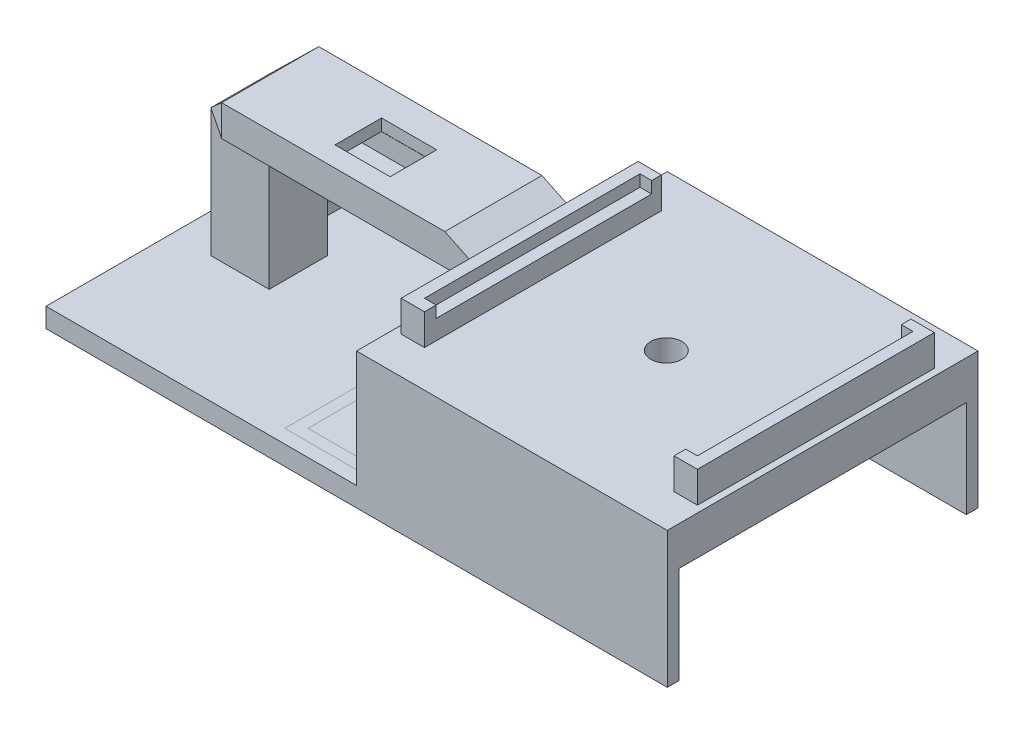
from build123d import *

# Parameters (mm, degrees)
ESQUISSE1_W                  = 150
ESQUISSE1_H                  = 80
BOSS_EXTRU_1_DEPTH           = 5
ESQUISSE2_W                  = 80
ESQUISSE2_H                  = 80
BOSS_EXTRU_2_DEPTH           = 30
ESQUISSE3_W                  = 75
ESQUISSE3_H                  = 80
ENL_V_MAT_EXTRU_1_DEPTH      = 25
ESQUISSE6_R                  = 4
ENL_V_MAT_EXTRU_2_DEPTH      = 40
ESQUISSE7_W                  = 6
ESQUISSE7_H                  = 61
BOSS_EXTRU_3_DEPTH           = 8
ESQUISSE9_W                  = 3
ESQUISSE9_H                  = 50
BOSS_EXTRU_4_DEPTH           = 0.0001
ESQUISSE10_W                 = 3
ESQUISSE10_H                 = 55.5
ENL_V_MAT_EXTRU_3_DEPTH      = 3
ESQUISSE11_W                 = 3
ESQUISSE11_H                 = 55.5
ENL_V_MAT_EXTRU_4_DEPTH      = 3
ESQUISSE12_W                 = 15
ESQUISSE12_H                 = 15
BOSS_EXTRU_5_DEPTH           = 40
BOSS_EXTRU_6_DEPTH           = 1
BOSS_EXTRU_6_DEPTH_BACK      = 7
ESQUISSE13_W                 = 44
ESQUISSE13_H                 = 25
BOSS_EXTRU_7_DEPTH           = 1
BOSS_EXTRU_7_DEPTH_BACK      = 7
ESQUISSE16_W                 = 23
ESQUISSE16_H                 = 12
ENL_V_MAT_EXTRU_5_DEPTH      = 5
ESQUISSE18_W                 = 14.2
ESQUISSE18_H                 = 12
ENL_V_MAT_EXTRU_7_DEPTH      = 5
ESQUISSE19_W                 = 25
ESQUISSE19_H                 = 8
BOSS_EXTRU_8_DEPTH           = 20
ENL_V_MAT_EXTRU_8_DEPTH      = 103.197148685
ESQUISSE21_W                 = 1.984335448
ESQUISSE21_H                 = 3
BOSS_EXTRU_9_DEPTH           = 25
ESQUISSE22_W                 = 3
ESQUISSE22_H                 = 25
BOSS_EXTRU_10_DEPTH          = 75
ESQUISSE23_W                 = 80
ESQUISSE23_H                 = 5
BOSS_EXTRU_11_DEPTH          = 9.96
ESQUISSE24_W                 = 11.416766346
ESQUISSE24_H                 = 16.447883718
BOSS_EXTRU_12_DEPTH          = 3
ENL_V_MAT_EXTRU_9_DEPTH      = 108.658959683
ENL_V_MAT_EXTRU_9_DEPTH_BACK = 108.658959683


with BuildPart() as part:
    # Esquisse1 → Boss.-Extru.1 (new body)
    with BuildSketch(Plane(origin=(0, 0, 0), x_dir=(1, 0, 0), z_dir=(0, 1, 0))):
        Rectangle(ESQUISSE1_W, ESQUISSE1_H)
    extrude(amount=BOSS_EXTRU_1_DEPTH)

    # Esquisse2 → Boss.-Extru.2 (add)
    with BuildSketch(Plane(origin=(0, 5, 0), x_dir=(1, 0, 0), z_dir=(0, 1, 0))):
        with Locations((35, 0)):
            Rectangle(ESQUISSE2_W, ESQUISSE2_H)
    extrude(amount=BOSS_EXTRU_2_DEPTH)

    # Esquisse3 → Enlèv. mat.-Extru.1 (cut)
    with BuildSketch(Plane.XZ):
        with Locations((37.5, 0)):
            Rectangle(ESQUISSE3_W, ESQUISSE3_H)
    extrude(amount=-ENL_V_MAT_EXTRU_1_DEPTH, mode=Mode.SUBTRACT)

    # Esquisse6 → Enlèv. mat.-Extru.2 (cut)
    with BuildSketch(Plane(origin=(0, 35, 0), x_dir=(1, 0, 0), z_dir=(0, 1, 0))):
        with Locations(Location((34.753416048, 0, 0), (0, 0, 270))):
            Circle(ESQUISSE6_R)
    extrude(amount=-ENL_V_MAT_EXTRU_2_DEPTH, mode=Mode.SUBTRACT)

    # Esquisse7 → Boss.-Extru.3 (add)
    with BuildSketch(Plane(origin=(0, 35, 0), x_dir=(1, 0, 0), z_dir=(0, 1, 0))):
        with Locations((-0.015664552, 0)):
            Rectangle(ESQUISSE7_W, ESQUISSE7_H)
        with Locations((70.25575127, 0)):
            Rectangle(ESQUISSE7_W, ESQUISSE7_H)
    extrude(amount=BOSS_EXTRU_3_DEPTH)

    # Esquisse9 → Boss.-Extru.4 (add)
    with BuildSketch(Plane(origin=(0, 5, 0), x_dir=(1, 0, 0), z_dir=(0, 1, 0))):
        Polygon((-27, -36.47894853), (-5, -36.47894853), (-5, -33.47894853), (-24, -33.47894853), (-27, -33.47894853), align=None)
        with Locations((-25.5, -8.47894853)):
            Rectangle(ESQUISSE9_W, ESQUISSE9_H)
    extrude(amount=BOSS_EXTRU_4_DEPTH)

    # Esquisse10 → Enlèv. mat.-Extru.3 (cut)
    with BuildSketch(Plane(origin=(0, 43, 0), x_dir=(1, 0, 0), z_dir=(0, 1, 0))):
        with Locations((1.484335448, 0.25)):
            Rectangle(ESQUISSE10_W, ESQUISSE10_H)
    extrude(amount=-ENL_V_MAT_EXTRU_3_DEPTH, mode=Mode.SUBTRACT)

    # Esquisse11 → Enlèv. mat.-Extru.4 (cut)
    with BuildSketch(Plane(origin=(0, 43, 0), x_dir=(1, 0, 0), z_dir=(0, 1, 0))):
        with Locations((68.75575127, 0.25)):
            Rectangle(ESQUISSE11_W, ESQUISSE11_H)
    extrude(amount=-ENL_V_MAT_EXTRU_4_DEPTH, mode=Mode.SUBTRACT)

    # Esquisse12 → Boss.-Extru.5 (add)
    with BuildSketch(Plane(origin=(0, 5, 0), x_dir=(1, 0, 0), z_dir=(0, 1, 0))):
        with Locations((-67.5, 0)):
            Rectangle(ESQUISSE12_W, ESQUISSE12_H)
    extrude(amount=BOSS_EXTRU_5_DEPTH)

    # Esquisse13 → Boss.-Extru.6 (add, two sides: drawn at the far end of the back side and taken through both)
    with BuildSketch(Plane(origin=(0, 45, 0), x_dir=(1, 0, 0), z_dir=(0, 1, 0)).offset(-BOSS_EXTRU_6_DEPTH_BACK)):
        with Locations((-44.729487472, -0.507142805)):
            Rectangle(ESQUISSE13_W, ESQUISSE13_H)
    extrude(amount=BOSS_EXTRU_6_DEPTH + BOSS_EXTRU_6_DEPTH_BACK)

    # Esquisse14 → Boss.-Extru.7 (add, two sides: drawn at the far end of the back side and taken through both)
    with BuildSketch(Plane(origin=(0, 45, 0), x_dir=(1, 0, 0), z_dir=(0, 1, 0)).offset(-BOSS_EXTRU_7_DEPTH_BACK)):
        Polygon((-66.729487472, -13.007142805), (-75, -7.5), (-75, 7.5), (-66.729487472, 11.992857195), align=None)
    extrude(amount=BOSS_EXTRU_7_DEPTH + BOSS_EXTRU_7_DEPTH_BACK)

    # Esquisse16 → Enlèv. mat.-Extru.5 (cut)
    with BuildSketch(Plane.XZ.offset(-38)):
        with Locations((-40, 1.869279691)):
            Rectangle(ESQUISSE16_W, ESQUISSE16_H)
    extrude(amount=-ENL_V_MAT_EXTRU_5_DEPTH, mode=Mode.SUBTRACT)

    # Esquisse18 → Enlèv. mat.-Extru.7 (cut)
    with BuildSketch(Plane.XZ.offset(-43)):
        with Locations((-35.637534585, 1.827095349)):
            Rectangle(ESQUISSE18_W, ESQUISSE18_H)
    extrude(amount=-ENL_V_MAT_EXTRU_7_DEPTH, mode=Mode.SUBTRACT)

    # Esquisse19 → Boss.-Extru.8 (add)
    with BuildSketch(Plane(origin=(-22.729487472, 0, 0), x_dir=(0, 0, -1), z_dir=(1, 0, 0))):
        with Locations((-0.507142805, 42)):
            Rectangle(ESQUISSE19_W, ESQUISSE19_H)
    extrude(amount=BOSS_EXTRU_8_DEPTH)

    # Esquisse20 → Enlèv. mat.-Extru.8 (cut, through all)
    with BuildSketch(Plane(origin=(0, 0, -11.992857195), x_dir=(-1, 0, 0), z_dir=(0, 0, -1))):
        Polygon((3.015664552, 43), (9.263117513, 46), (2.729487472, 46), (2.729487472, 43), align=None)
    extrude(amount=-ENL_V_MAT_EXTRU_8_DEPTH, mode=Mode.SUBTRACT)

    # Esquisse21 → Boss.-Extru.9 (add)
    with BuildSketch(Plane(origin=(0, 0, -11.992857195), x_dir=(-1, 0, 0), z_dir=(0, 0, -1))):
        with Locations((4.007832276, 36.5)):
            Rectangle(ESQUISSE21_W, ESQUISSE21_H)
    extrude(amount=-BOSS_EXTRU_9_DEPTH)

    # Esquisse22 → Boss.-Extru.10 (add)
    with BuildSketch(Plane(origin=(0, 0, 0), x_dir=(0, 0, -1), z_dir=(1, 0, 0))):
        with Locations((-38.5, 12.5)):
            Rectangle(ESQUISSE22_W, ESQUISSE22_H)
    boss_extru_10 = extrude(amount=BOSS_EXTRU_10_DEPTH)

    # Symétrie1: Boss.-Extru.10 across plane
    add(boss_extru_10.mirror(Plane.XY))

    # Esquisse23 → Boss.-Extru.11 (add)
    with BuildSketch(Plane.ZY.offset(75)):
        with Locations((0, 2.5)):
            Rectangle(ESQUISSE23_W, ESQUISSE23_H)
    extrude(amount=BOSS_EXTRU_11_DEPTH)

    # Esquisse24 → Boss.-Extru.12 (add)
    with BuildSketch(Plane(origin=(0, 5, 4.193760708), x_dir=(1, 0, 0), z_dir=(0, 1, 0))):
        with Locations((-74.621764305, 25.318857606)):
            Rectangle(ESQUISSE24_W, ESQUISSE24_H)
    extrude(amount=BOSS_EXTRU_12_DEPTH)

    # Esquisse25 → Enlèv. mat.-Extru.9 (cut, two sides: drawn at the far end of the back side and taken through both)
    with BuildSketch(Plane.XY.offset(7.5).offset(-ENL_V_MAT_EXTRU_9_DEPTH_BACK)):
        Polygon((-304.628474167, -184.117769245), (-75, 38), (-66.729487472, 46), (162.898986696, 268.117769245), (-281.336551795, 727.37471758), (-748.864012658, 275.139179089), align=None)
    extrude(amount=ENL_V_MAT_EXTRU_9_DEPTH + ENL_V_MAT_EXTRU_9_DEPTH_BACK, mode=Mode.SUBTRACT)


solid = part.part
